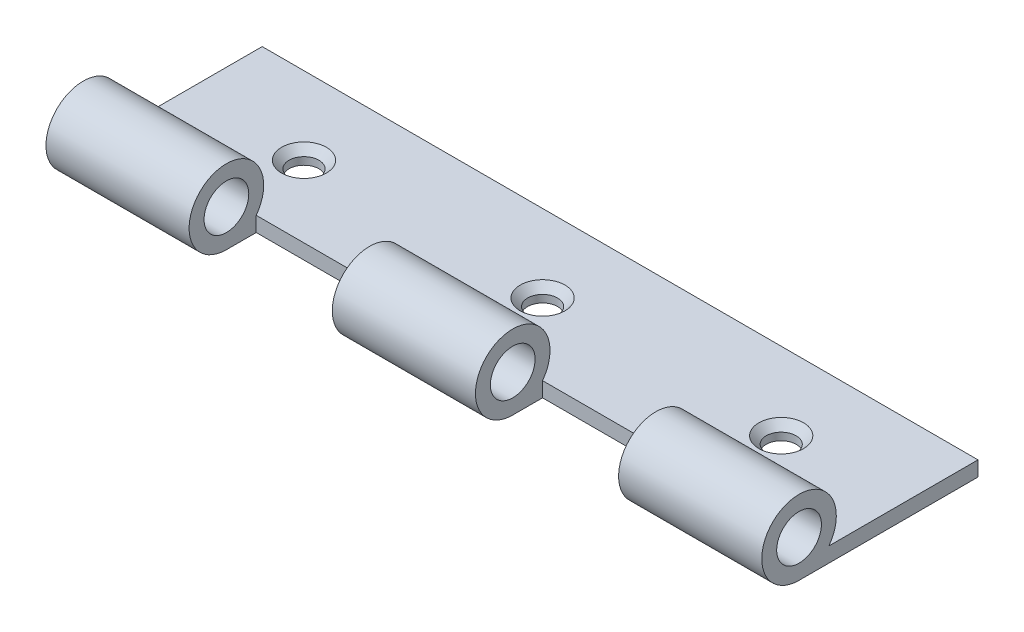
from build123d import *

# Parameters (mm, degrees)
SKETCH1_W                  = 76.2
SKETCH1_H                  = 19.05
BOSS_EXTRUDE1_DEPTH        = 1.5875
SKETCH2_R                  = 3.96875
SKETCH2_R_2                = 2.38125
BOSS_EXTRUDE2_DEPTH        = 76.2
SKETCH4_R                  = 1.5875
CUT_EXTRUDE1_DEPTH         = 41.914713601
CHAMFER1_SIZE              = 0.79375
LPATTERN1_COUNT            = 3
LPATTERN1_PITCH            = 25.4
CHAMFER1_OF_LPATTERN1_SIZE = 0.79375
CUT_EXTRUDE2_START         = -15.24
CUT_EXTRUDE2_DEPTH         = 15.24
LPATTERN2_COUNT            = 5
LPATTERN2_PITCH            = 15.24


with BuildPart() as part:
    # Sketch1 → Boss-Extrude1 (new body)
    with BuildSketch(Plane(origin=(0, 0, 0), x_dir=(1, 0, 0), z_dir=(0, 1, 0))):
        Rectangle(SKETCH1_W, SKETCH1_H)
    extrude(amount=BOSS_EXTRUDE1_DEPTH)

    # Sketch2 → Boss-Extrude2 (add)
    with BuildSketch(Plane(origin=(38.1, 0, 0), x_dir=(0, 0, -1), z_dir=(1, 0, 0))):
        with Locations((-9.525, 3.96875)):
            Circle(SKETCH2_R)
        with Locations((-9.525, 3.96875)):
            Circle(SKETCH2_R_2, mode=Mode.SUBTRACT)
    extrude(amount=-BOSS_EXTRUDE2_DEPTH)

    # Sketch4 → Cut-Extrude1 (cut, through all)
    with BuildSketch(Plane(origin=(0, 1.5875, 0), x_dir=(1, 0, 0), z_dir=(0, 1, 0))):
        with Locations(Location((-25.4, 1.275, 0), (0, 0, 270))):
            Circle(SKETCH4_R)
    cut_extrude1 = extrude(amount=-CUT_EXTRUDE1_DEPTH, mode=Mode.SUBTRACT)

    # Chamfer1
    chamfer1_edges = [part.edges().sort_by_distance(p)[0] for p in [
        (-25.4, 1.5875, -2.8625),
    ]]
    chamfer(chamfer1_edges, length=CHAMFER1_SIZE)

    # LPattern1: Cut-Extrude1 ×3
    with Locations(*[(i * LPATTERN1_PITCH, 0, 0) for i in range(1, LPATTERN1_COUNT)]):
        add(cut_extrude1, mode=Mode.SUBTRACT)

    # Chamfer1 of LPattern1
    chamfer1_of_lpattern1_edges = [part.edges().sort_by_distance(p)[0] for p in [
        (0, 1.5875, -2.8625),
        (25.4, 1.5875, -2.8625),
    ]]
    chamfer(chamfer1_of_lpattern1_edges, length=CHAMFER1_OF_LPATTERN1_SIZE)

    # Sketch5 → Cut-Extrude2 (cut)
    with BuildSketch(Plane(origin=(38.1, 0, 0), x_dir=(0, 0, -1), z_dir=(1, 0, 0)).offset(CUT_EXTRUDE2_START)):
        with BuildLine():
            Line((-6.35, 1.5875), (-6.35, 0))
            Line((-6.35, 0), (-9.525, 0))
            ThreePointArc((-9.525, 0), (-11.299878957, 7.518507914), (-6.35, 1.5875))
        make_face()
    cut_extrude2 = extrude(amount=-CUT_EXTRUDE2_DEPTH, mode=Mode.SUBTRACT)

    # LPattern2: Cut-Extrude2 ×5, 2 skipped
    with Locations(*[(-i * LPATTERN2_PITCH, 0, 0) for i in range(1, LPATTERN2_COUNT) if i not in (1, 3)]):
        add(cut_extrude2, mode=Mode.SUBTRACT)


solid = part.part
